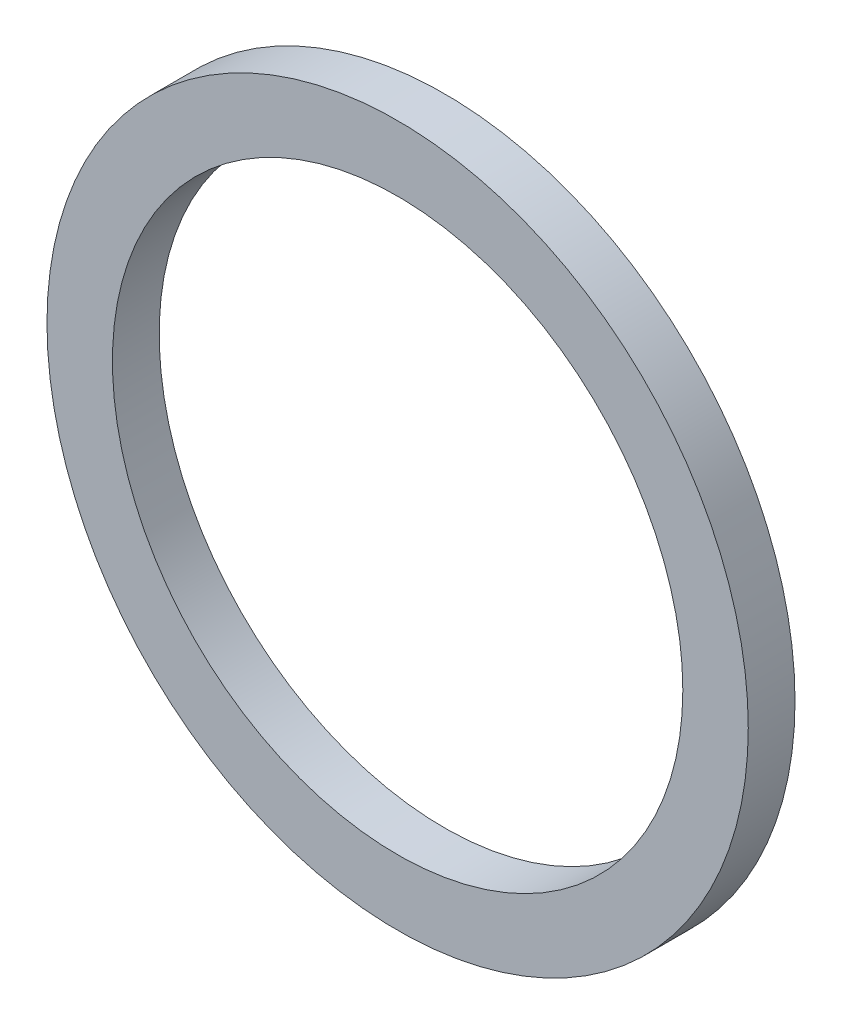
from build123d import *

# Parameters (mm, degrees)
SKETCH_1_R      = 15
SKETCH_1_R_2    = 12.2
EXTRUDE_1_DEPTH = 2


with BuildPart() as part:
    # Эскиз1 → Бобышка-Вытянуть1 (new body)
    with BuildSketch(Plane.XY):
        Circle(SKETCH_1_R)
        Circle(SKETCH_1_R_2, mode=Mode.SUBTRACT)
    extrude(amount=EXTRUDE_1_DEPTH)


solid = part.part
